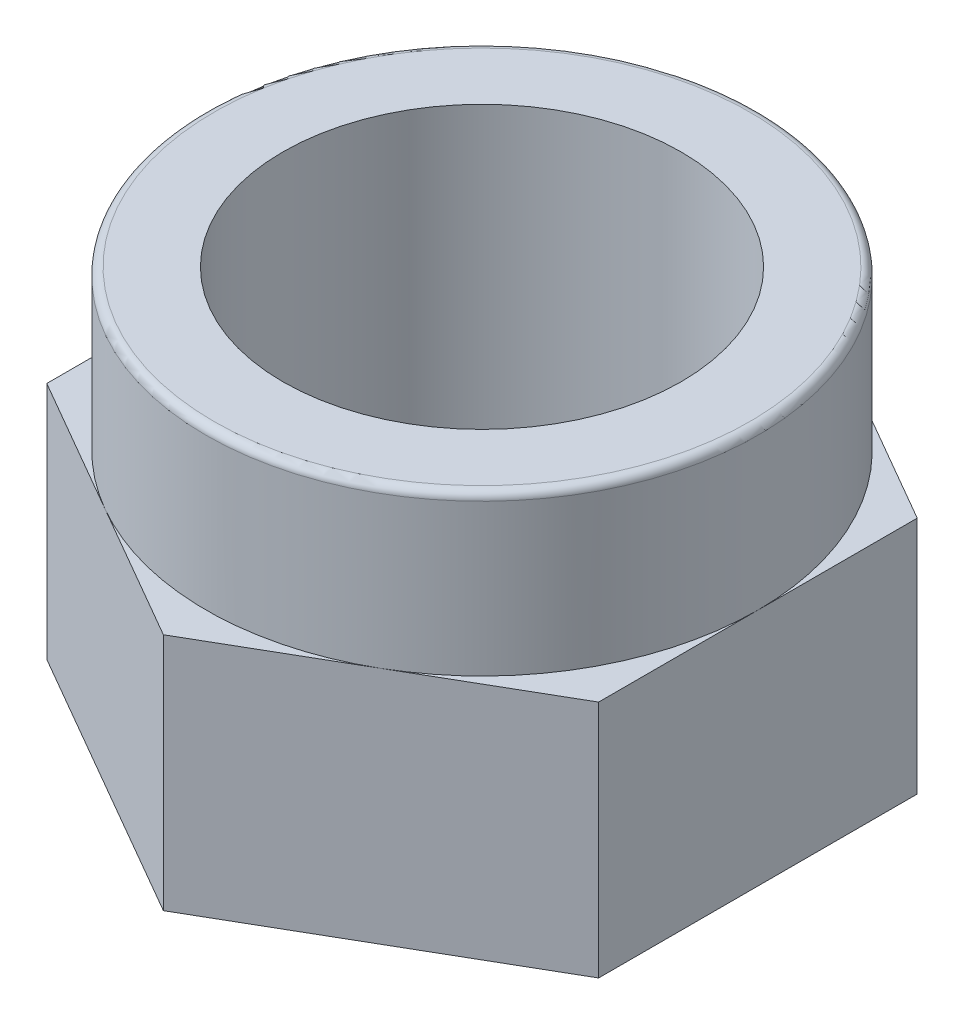
from build123d import *

# Parameters (mm, degrees)
SKETCH1_R           = 2.5
BOSS_EXTRUDE1_DEPTH = 3
SKETCH2_R           = 3.464101615
SKETCH2_R_2         = 2.5
BOSS_EXTRUDE2_DEPTH = 2
FILLET1_R           = 0.1


with BuildPart() as part:
    # Sketch1 → Boss-Extrude1 (new body)
    with BuildSketch(Plane(origin=(0, 0, 0), x_dir=(1, 0, 0), z_dir=(0, 1, 0))):
        Polygon((0, 4), (-3.464101615, 2), (-3.464101615, -2), (0, -4), (3.464101615, -2), (3.464101615, 2), align=None)
        with Locations(Location((0, 0, 0), (0, 0, 270))):
            Circle(SKETCH1_R, mode=Mode.SUBTRACT)
    extrude(amount=BOSS_EXTRUDE1_DEPTH)

    # Sketch2 → Boss-Extrude2 (add)
    with BuildSketch(Plane(origin=(0, 3, 0), x_dir=(1, 0, 0), z_dir=(0, 1, 0))):
        with Locations(Location((0, 0, 0), (0, 0, 60))):
            Circle(SKETCH2_R)
        with Locations(Location((0, 0, 0), (0, 0, 270))):
            Circle(SKETCH2_R_2, mode=Mode.SUBTRACT)
    extrude(amount=BOSS_EXTRUDE2_DEPTH)

    # Fillet1
    fillet1_edges = [part.edges().sort_by_distance(p)[0] for p in [
        (-1.732050808, 5, 3),
    ]]
    fillet(fillet1_edges, radius=FILLET1_R)


solid = part.part
